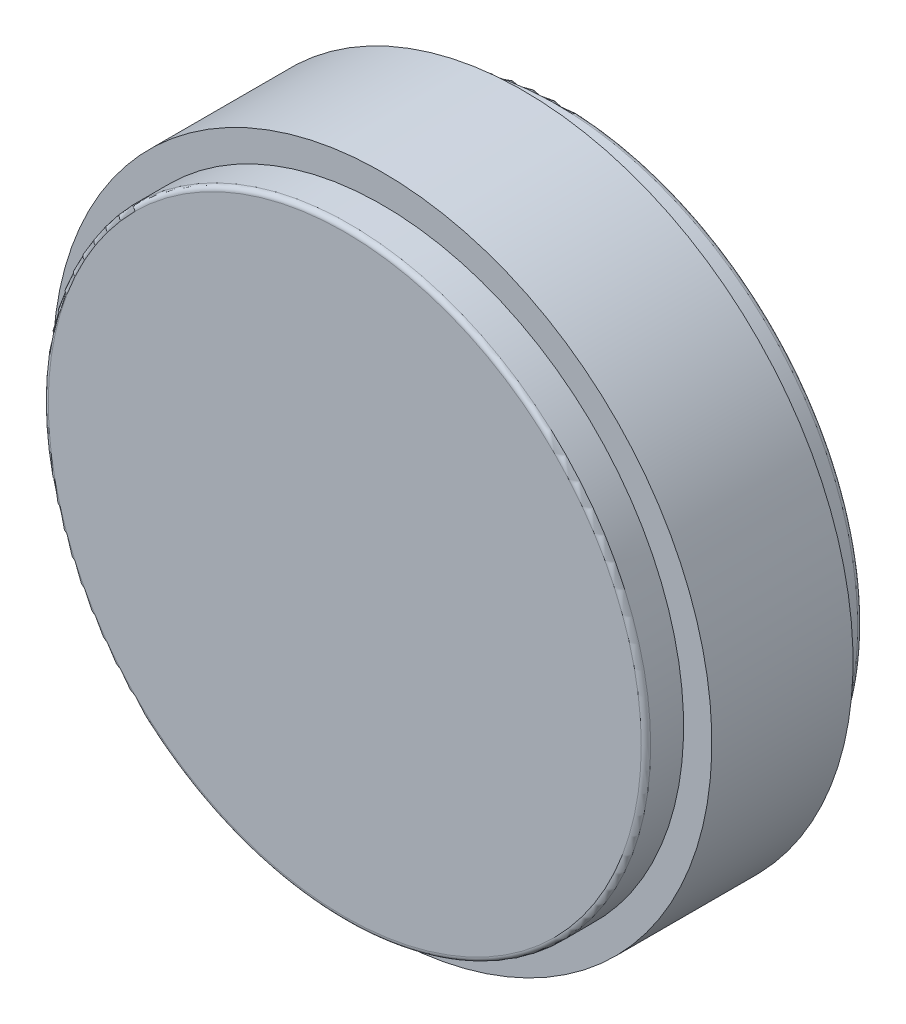
from build123d import *

# Parameters (mm, degrees)
FILLET_1_R          = 0.5
SKETCH_2_R          = 12.5
CUT_EXTRUDE_1_DEPTH = 0.5


with BuildPart() as part:
    # Эскиз1 → Повернуть1 (revolve)
    with BuildSketch(Plane(origin=(0, 0, 0), x_dir=(1, 0, 0), z_dir=(0, 1, 0))):
        Polygon((0, 0), (-32, 0), (-32, 4), (-35, 4), (-35, 19), (-32, 19), (-32, 23), (0, 23), align=None)
    revolve(axis=Axis((0, 0, -23), (0, 0, 1)))

    # Скругление1
    fillet_1_edges = [part.edges().sort_by_distance(p)[0] for p in [
        (32, 0, -23),
        (32, 0, 0),
    ]]
    fillet(fillet_1_edges, radius=FILLET_1_R)

    # Эскиз2 → Вырез-Вытянуть1 (cut)
    with BuildSketch(Plane(origin=(0, 0, -23), x_dir=(-1, 0, 0), z_dir=(0, 0, -1))):
        Circle(SKETCH_2_R)
    extrude(amount=-CUT_EXTRUDE_1_DEPTH, mode=Mode.SUBTRACT)

    # Эскиз3 → Вырез-Повернуть1 (revolve, cut)
    with BuildSketch(Plane(origin=(0, 0, 0), x_dir=(0, 0, -1), z_dir=(1, 0, 0)), mode=Mode.PRIVATE) as cut_revolve_1_sk:
        Polygon((22.5, 0), (19.5, 0), (22.5, 3), align=None)
    revolve(cut_revolve_1_sk.sketch.rotate(Axis((0, 0, -22.5), (0, 0, 1)), 270), axis=Axis((0, 0, -22.5), (0, 0, 1)), mode=Mode.SUBTRACT)


solid = part.part
